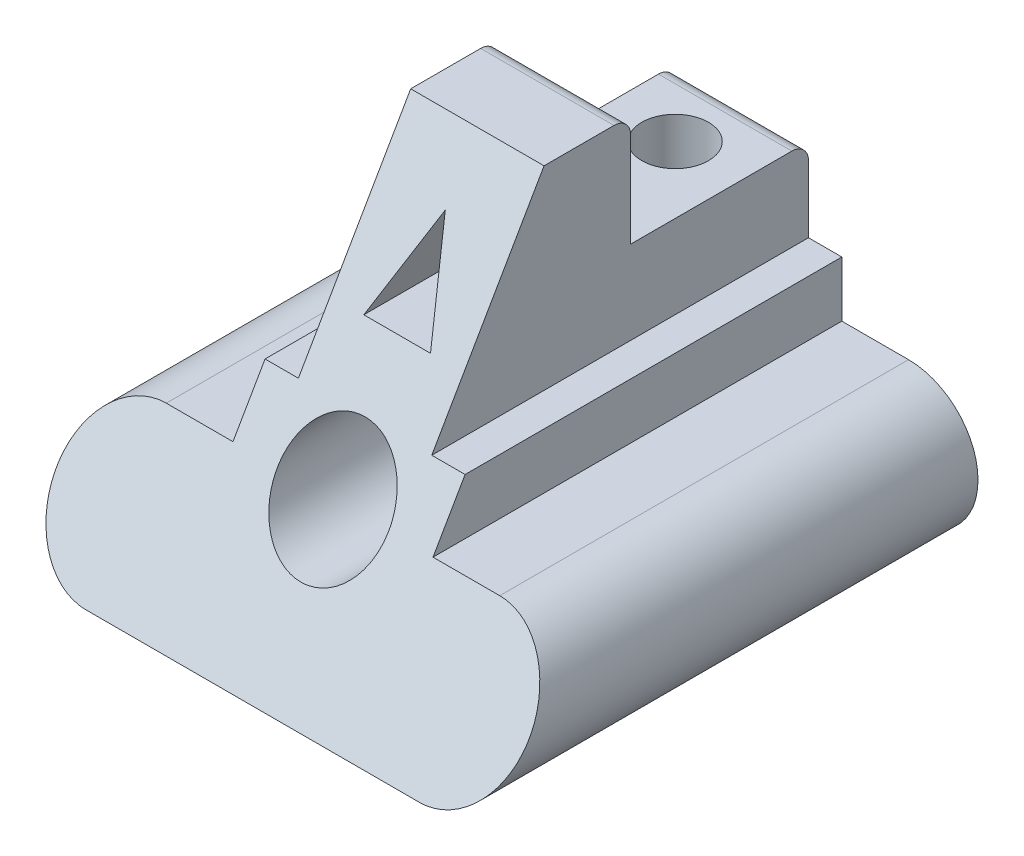
from build123d import *

# Parameters (mm, degrees)
ESBO_O1_R                         = 10
RESSALTO_EXTRUS_O1_DEPTH          = 88
ESBO_O1_6_W                       = 24
ESBO_O1_6_H                       = 20
RESSALTO_EXTRUS_O2_DEPTH          = 56
CORTE_EXTRUS_O1_REACH             = 126.957
CORTE_EXTRUS_O1_DIRECTION_2_REACH = 126.957
CORTE_EXTRUS_O2_DEPTH             = 50
CORTE_EXTRUS_O6_REACH             = 126.5
ESBO_O3_R                         = 6
FILETE1_R                         = 3
FILETE2_R                         = 3


with BuildPart() as part:
    # Esboço1 → Ressalto-extrusão1 (new body)
    with BuildSketch(Plane.XY):
        with BuildLine():
            Line((-48, 25), (-60, 25))
            ThreePointArc((-60, 25), (-72.5, 12.5), (-60, 0))
            Line((-60, 0), (0, 0))
            ThreePointArc((0, 0), (12.5, 12.5), (0, 25))
            Line((0, 25), (-12, 25))
            Line((-12, 25), (-12, 35))
            Line((-12, 35), (-18, 35))
            Line((-18, 35), (-18, 50))
            Line((-18, 50), (-42, 50))
            Line((-42, 50), (-42, 35))
            Line((-42, 35), (-48, 35))
            Line((-48, 35), (-48, 25))
        make_face()
        with Locations((-30, 25)):
            Circle(ESBO_O1_R, mode=Mode.SUBTRACT)
    extrude(amount=-RESSALTO_EXTRUS_O1_DEPTH)

    # Esboço1<6> → Ressalto-extrusão2 (add)
    with BuildSketch(Plane.XY):
        with Locations((-30, 60)):
            Rectangle(ESBO_O1_6_W, ESBO_O1_6_H)
    extrude(amount=-RESSALTO_EXTRUS_O2_DEPTH)

    # Esboço2 → Corte-extrusão1 (cut, up to next)
    with BuildSketch(Plane.ZY.offset(42), mode=Mode.PRIVATE) as corte_extrus_o1_sk1:
        Polygon((-40.414518843, 70), (0, 0), (0, 70), align=None)
    corte_extrus_o1_tool1 = extrude(corte_extrus_o1_sk1.sketch, amount=-CORTE_EXTRUS_O1_REACH, mode=Mode.PRIVATE) & part.part
    add(corte_extrus_o1_tool1.solids().sort_by_distance((-42, 46.666667, -13.471506))[0], mode=Mode.SUBTRACT)

    # Esboço2 → Corte-extrusão1 direction 2 (cut, up to next)
    with BuildSketch(Plane.ZY.offset(42), mode=Mode.PRIVATE) as corte_extrus_o1_direction_2_sk1:
        Polygon((-40.414518843, 70), (0, 0), (0, 70), align=None)
    corte_extrus_o1_direction_2_tool1 = extrude(corte_extrus_o1_direction_2_sk1.sketch, amount=CORTE_EXTRUS_O1_DIRECTION_2_REACH, mode=Mode.PRIVATE) & part.part
    add(corte_extrus_o1_direction_2_tool1.solids().sort_by_distance((-42, 46.666667, -13.471506))[0], mode=Mode.SUBTRACT)

    # Esboço1<8> → Corte-extrusão2 (cut)
    with BuildSketch(Plane.XY):
        Polygon((-36, 45), (-24, 45), (-30, 60), align=None)
    extrude(amount=-CORTE_EXTRUS_O2_DEPTH, mode=Mode.SUBTRACT)

    # Esboço3 → Corte-extrusão6 (cut, up to next)
    with BuildSketch(Plane(origin=(0, 50, 0), x_dir=(1, 0, 0), z_dir=(0, 1, 0)), mode=Mode.PRIVATE) as corte_extrus_o6_sk1:
        with Locations((-30, 76)):
            Circle(ESBO_O3_R)
    corte_extrus_o6_tool1 = extrude(corte_extrus_o6_sk1.sketch, amount=-CORTE_EXTRUS_O6_REACH, mode=Mode.PRIVATE) & part.part
    add(corte_extrus_o6_tool1.solids().sort_by_distance((-30, 50, -76))[0], mode=Mode.SUBTRACT)

    # Filete1
    filete1_edges = [part.edges().sort_by_distance(p)[0] for p in [
        (-30, 70, -56),
    ]]
    fillet(filete1_edges, radius=FILETE1_R)

    # Filete2
    filete2_edges = [part.edges().sort_by_distance(p)[0] for p in [
        (-30, 50, -88),
    ]]
    fillet(filete2_edges, radius=FILETE2_R)


solid = part.part
